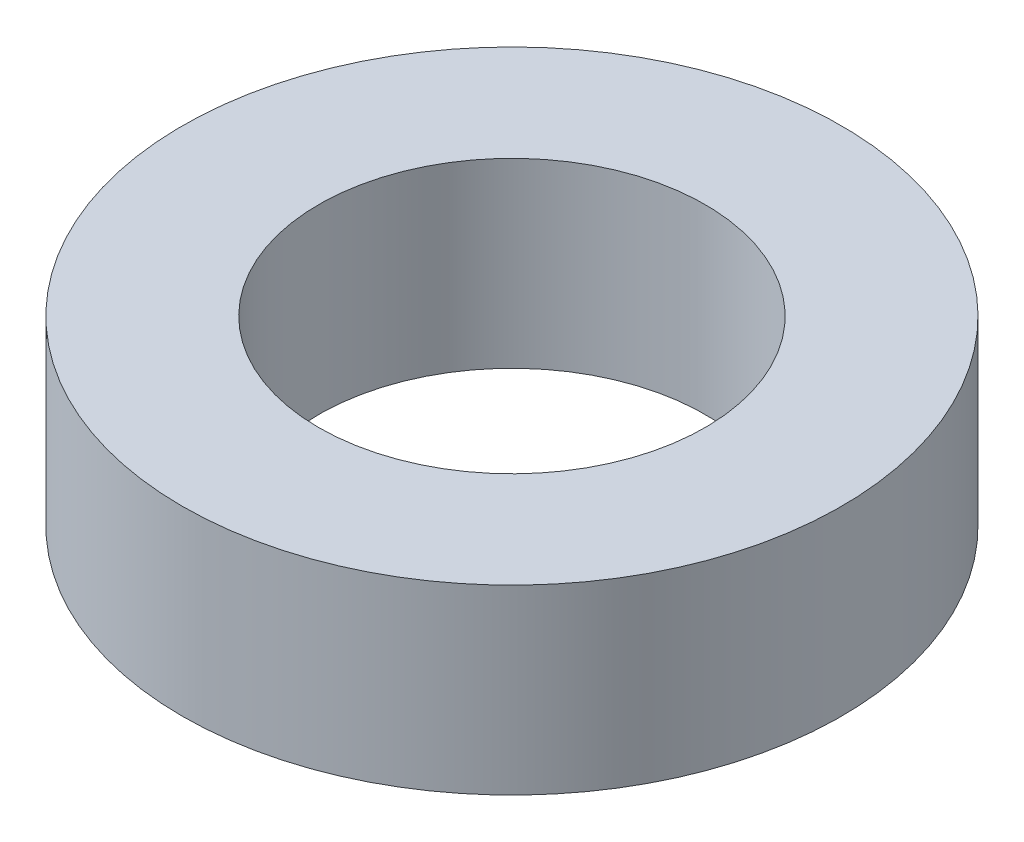
from build123d import *

# Parameters (mm, degrees)
SKETCH1_R           = 7.25
SKETCH1_R_2         = 4.25
BOSS_EXTRUDE1_DEPTH = 4


with BuildPart() as part:
    # Sketch1 → Boss-Extrude1 (new body)
    with BuildSketch(Plane(origin=(0, 0, 0), x_dir=(1, 0, 0), z_dir=(0, 1, 0))):
        with Locations(Location((0, 0, 0), (0, 0, 270))):
            Circle(SKETCH1_R)
        with Locations(Location((0, 0, 0), (0, 0, 270))):
            Circle(SKETCH1_R_2, mode=Mode.SUBTRACT)
    extrude(amount=BOSS_EXTRUDE1_DEPTH)


solid = part.part
